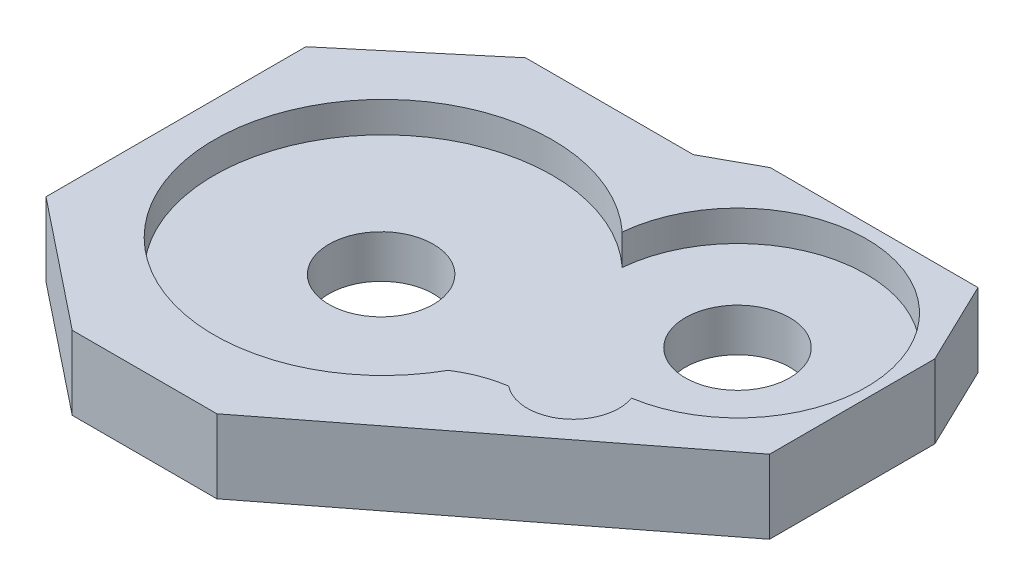
from build123d import *

# Parameters (mm, degrees)
EXTRUDE_START       = -2
EXTRUDE_1_DEPTH     = 12
CUT_EXTRUDE_1_DEPTH = 5
SKETCH_4_R          = 8.5
CUT_EXTRUDE_2_DEPTH = 109.143461437


with BuildPart() as part:
    # Эскиз1 → Вытянуть1 (new body)
    with BuildSketch(Plane(origin=(0, 0, 0), x_dir=(1, 0, 0), z_dir=(0, 1, 0)).offset(EXTRUDE_START)):
        Polygon((41.234335961, 16.139303033), (49.33132622, 20.576367476), (83.159652077, 20.576367476), (89.695898477, 7.004834382), (89.695898477, -19.904859962), (38.978411799, -59.208563976), (15.42620007, -59.208563976), (-5.538491663, -42.514725177), (-5.538491663, -0.189156064), (13.914350861, 16.139303033), align=None)
    extrude(amount=EXTRUDE_1_DEPTH)

    # Эскиз2 → Вырез-Вытянуть1 (cut)
    with BuildSketch(Plane(origin=(0, 10, 0), x_dir=(1, 0, 0), z_dir=(0, 1, 0))):
        with BuildLine():
            ThreePointArc((46.353434454, -0.558740061), (0.463282904, -25.097768311), (51.691914237, -34.246388345))
            ThreePointArc((51.691914237, -34.246388345), (55.121981017, -32.508830766), (58.84329247, -31.541201954))
            ThreePointArc((58.84329247, -31.541201954), (67.819533531, -31.785998768), (70.560678986, -23.235036795))
            ThreePointArc((70.560678986, -23.235036795), (81.500890347, 12.702706564), (46.353434454, -0.558740061))
        make_face()
    extrude(amount=-CUT_EXTRUDE_1_DEPTH, mode=Mode.SUBTRACT)

    # Эскиз4 → Вырез-Вытянуть2 (cut, through all)
    with BuildSketch(Plane.XZ.offset(2)):
        with Locations(Location((27.688571463, 21.162784436, 0), (0, 0, 270))):
            Circle(SKETCH_4_R)
        with Locations(Location((67.068947784, 2.498184147, 0), (0, 0, 270))):
            Circle(SKETCH_4_R)
    extrude(amount=-CUT_EXTRUDE_2_DEPTH, mode=Mode.SUBTRACT)


solid = part.part
